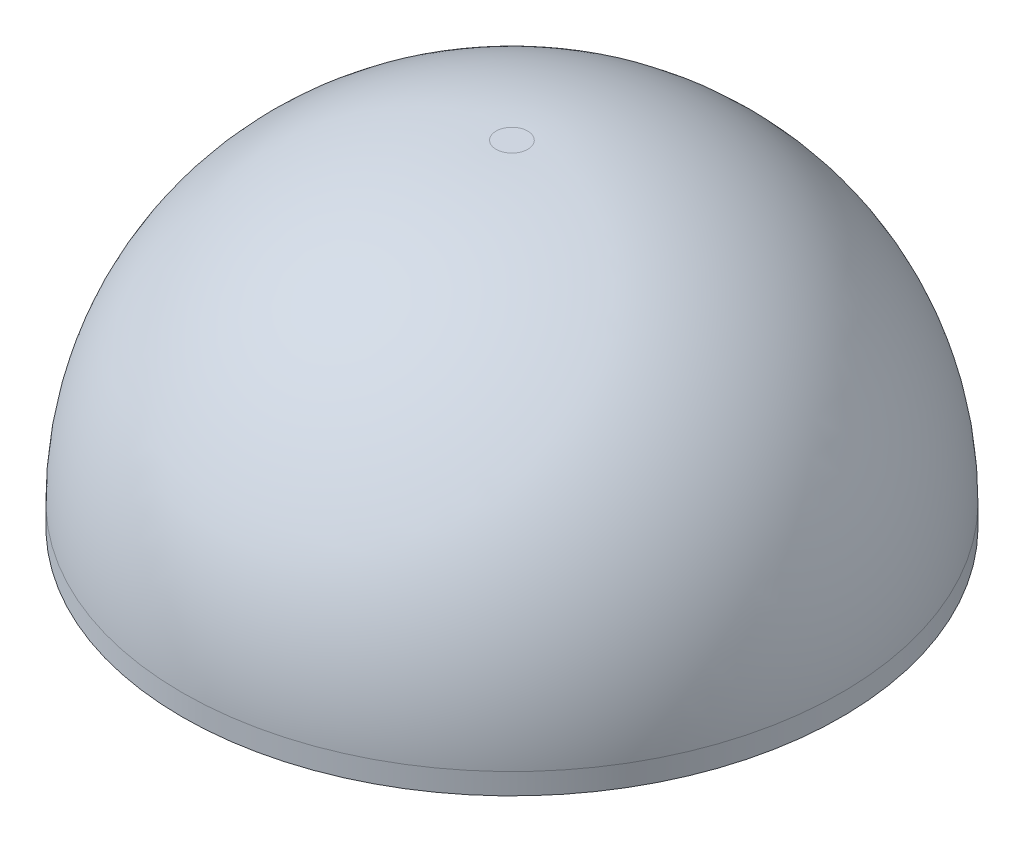
from build123d import *

# Parameters (mm, degrees)
SKETCH1_R           = 2.5
BOSS_EXTRUDE1_DEPTH = 2.54
FILLET3_R           = 2.38


with BuildPart() as part:
    # Sketch1 → Boss-Extrude1 (new body)
    with BuildSketch(Plane(origin=(0, 0, 0), x_dir=(1, 0, 0), z_dir=(0, 1, 0))):
        with Locations(Location((0, 0, 0), (0, 0, 270))):
            Circle(SKETCH1_R)
    extrude(amount=BOSS_EXTRUDE1_DEPTH)

    # Fillet3
    fillet3_edges = [part.edges().sort_by_distance(p)[0] for p in [
        (0, 2.54, -2.5),
    ]]
    fillet(fillet3_edges, radius=FILLET3_R)


solid = part.part
